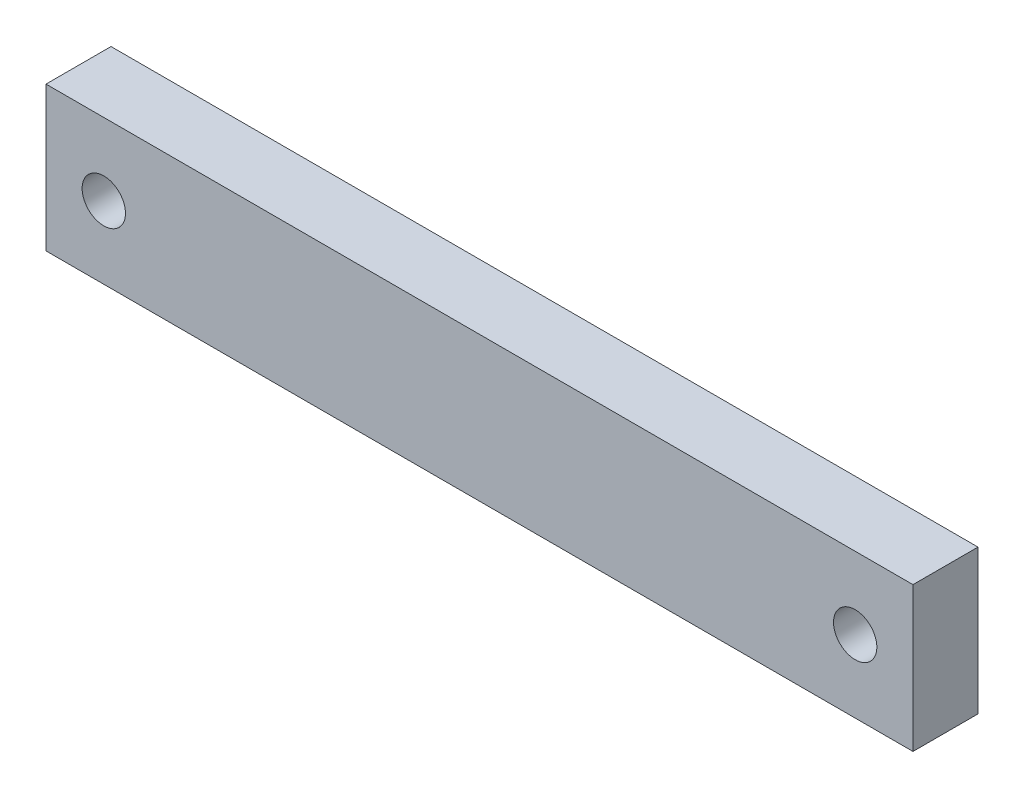
from build123d import *

# Parameters (mm, degrees)
SKETCH1_W           = 60
SKETCH1_H           = 10
SKETCH1_R           = 1.5
BOSS_EXTRUDE1_DEPTH = 4.5


with BuildPart() as part:
    # Sketch1 → Boss-Extrude1 (new body)
    with BuildSketch(Plane.XY):
        Rectangle(SKETCH1_W, SKETCH1_H)
        with Locations((-26, 0)):
            Circle(SKETCH1_R, mode=Mode.SUBTRACT)
        with Locations((26, 0)):
            Circle(SKETCH1_R, mode=Mode.SUBTRACT)
    extrude(amount=BOSS_EXTRUDE1_DEPTH)


solid = part.part
